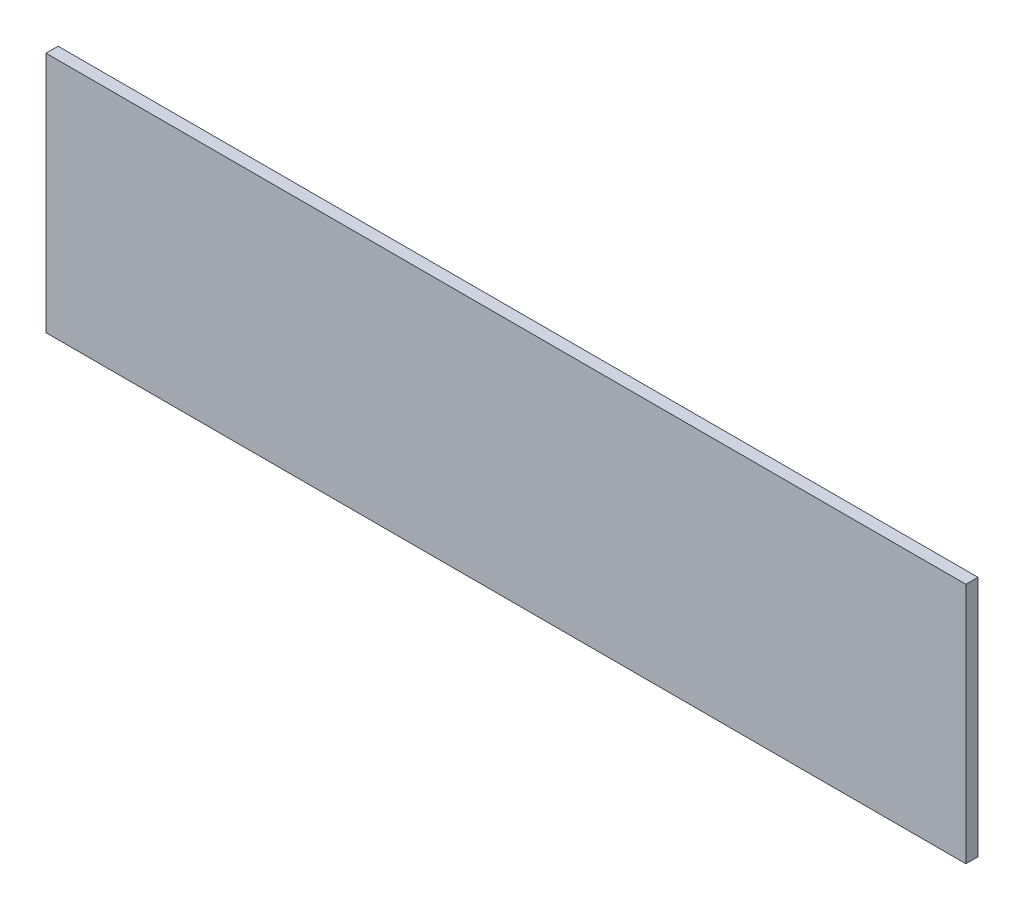
from build123d import *

# Parameters (mm, degrees)
ESQUISSE1_W        = 380
ESQUISSE1_H        = 100
BOSS_EXTRU_1_DEPTH = 5


with BuildPart() as part:
    # Esquisse1 → Boss.-Extru.1 (new body)
    with BuildSketch(Plane.XY):
        with Locations((50.554341942, 50.719339623)):
            Rectangle(ESQUISSE1_W, ESQUISSE1_H)
    extrude(amount=BOSS_EXTRU_1_DEPTH)


solid = part.part
